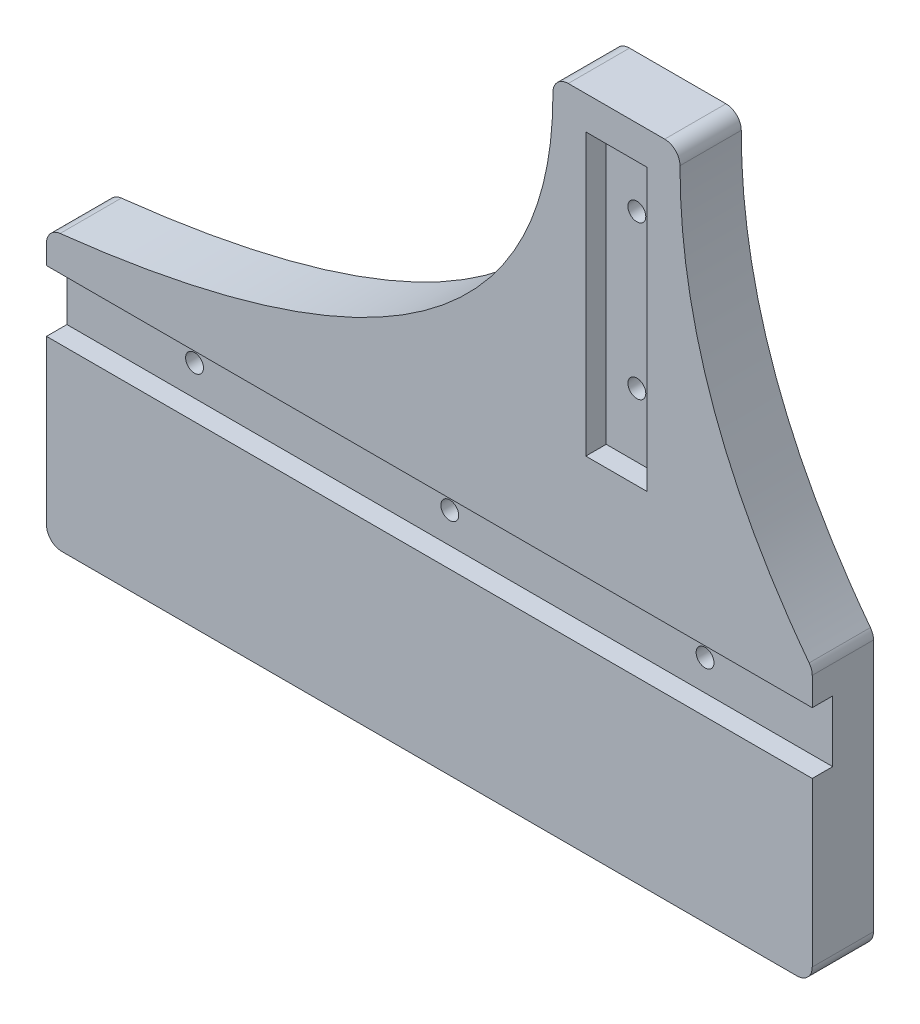
from build123d import *

# Parameters (mm, degrees)
SKIZZE1_R                       = 1.75
AUFSATZ_LINEAR_AUSTRAGEN1_DEPTH = 12
SKIZZE1_4_W                     = 150
SKIZZE1_4_H                     = 12
SKIZZE1_4_W_2                   = 12
SKIZZE1_4_H_2                   = 55
SKIZZE1_4_R                     = 1.75
SCHNITT_LINEAR_AUSTRAGEN2_DEPTH = 4
VERRUNDUNG1_R                   = 3


with BuildPart() as part:
    # Skizze1 → Aufsatz-Linear austragen1 (new body)
    with BuildSketch(Plane.XY):
        with BuildLine():
            Line((49.14, 88), (24.14, 88))
            add(Edge.make_bspline(
                [(24.14, 88), (26.807525043, 22.962561466), (-75, 12.5)],
                knots=[0, 0, 0, 1, 1, 1], degree=2))
            Line((-75, 12.5), (-75, -41))
            Line((-75, -41), (75, -41))
            Line((75, -41), (75, 12.5))
            add(Edge.make_bspline(
                [(49.14, 88), (47.999428855, 47.699903884), (75, 12.5)],
                knots=[0, 0, 0, 1, 1, 1], degree=2))
        make_face()
        with Locations((50, 0)):
            Circle(SKIZZE1_R, mode=Mode.SUBTRACT)
        with Locations((-50, 0)):
            Circle(SKIZZE1_R, mode=Mode.SUBTRACT)
        Circle(SKIZZE1_R, mode=Mode.SUBTRACT)
        with Locations((36.64, 39)):
            Circle(SKIZZE1_R, mode=Mode.SUBTRACT)
        with Locations((36.64, 69)):
            Circle(SKIZZE1_R, mode=Mode.SUBTRACT)
    extrude(amount=-AUFSATZ_LINEAR_AUSTRAGEN1_DEPTH)

    # Skizze1<4> → Schnitt-Linear austragen2 (cut)
    # profile 1 of 2: a face of its own
    with BuildSketch(Plane.XY):
        Rectangle(SKIZZE1_4_W, SKIZZE1_4_H)
    # profile 2 of 2: a face of its own
    with BuildSketch(Plane.XY):
        with Locations((36.64, 54)):
            Rectangle(SKIZZE1_4_W_2, SKIZZE1_4_H_2)
        with Locations((36.64, 39)):
            Circle(SKIZZE1_4_R, mode=Mode.SUBTRACT)
        with Locations((36.64, 69)):
            Circle(SKIZZE1_4_R, mode=Mode.SUBTRACT)
    extrude(amount=-SCHNITT_LINEAR_AUSTRAGEN2_DEPTH, mode=Mode.SUBTRACT)

    # Verrundung1
    verrundung1_edges = [part.edges().sort_by_distance(p)[0] for p in [
        (75, -41, -6),
        (75, 12.5, -6),
        (49.14, 88, -6),
        (-75, -41, -6),
        (-75, 12.5, -6),
        (24.14, 88, -6),
    ]]
    fillet(verrundung1_edges, radius=VERRUNDUNG1_R)


solid = part.part
